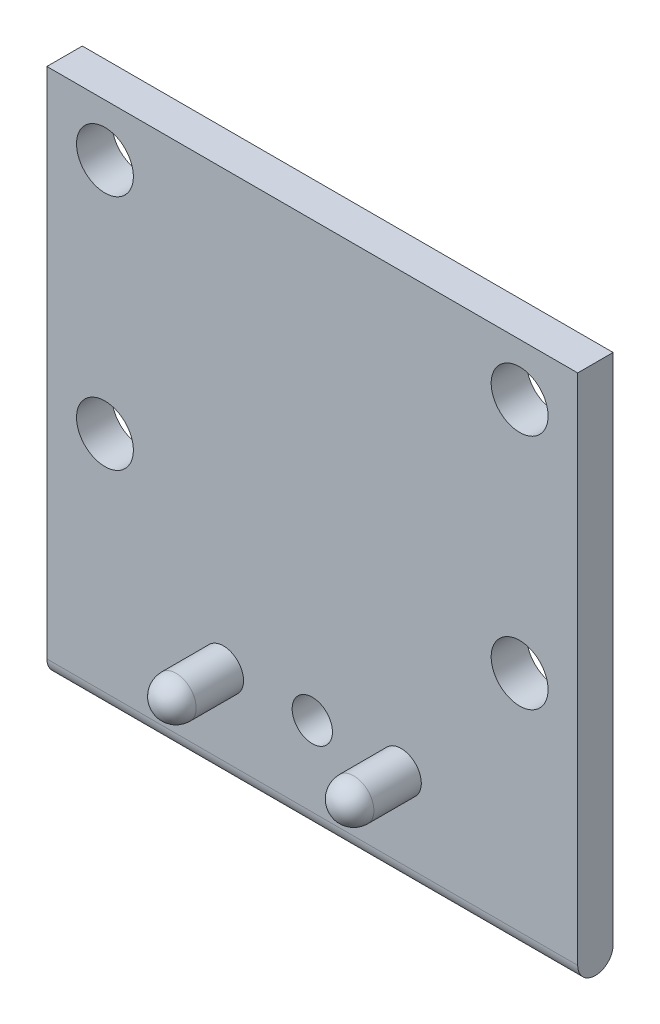
from build123d import *

# Parameters (mm, degrees)
SKETCH1_W            = 44.8
SKETCH1_H            = 2.99
BOSS_EXTRUDE1_DEPTH  = 44.8
FILLET1_RADIUS       = 1.495
FILLET1_LENGTH       = 44.8
M4_CLEARANCE_HOLE1_D = 4.8
M3_CLEARANCE_HOLE1_D = 3.4
SKETCH8_R            = 1.7
BOSS_EXTRUDE2_DEPTH  = 4
REVOLVE1_ANGLE       = 180
REVOLVE2_ANGLE       = 180


with BuildPart() as part:
    # Sketch1 → Boss-Extrude1 (new body)
    with BuildSketch(Plane(origin=(0, 0, 0), x_dir=(1, 0, 0), z_dir=(0, 1, 0))):
        Rectangle(SKETCH1_W, SKETCH1_H)
    extrude(amount=BOSS_EXTRUDE1_DEPTH)

    # Fillet1: full round fillet: the end face becomes a half cylinder, R = half its width
    fillet1_face = Plane((0, 0, 0), x_dir=(-1, 0, 0), z_dir=(0, -1, 0))  # on the end face: x along it, z out of the body
    fillet1_slab = fillet1_face.offset(-FILLET1_RADIUS / 2) * Box(FILLET1_LENGTH, 2 * FILLET1_RADIUS, FILLET1_RADIUS, mode=Mode.PRIVATE)  # the body's end, R deep
    fillet1_round = Plane((0, 1.495, 0), x_dir=(0, -1, 0), z_dir=(-1, 0, 0)) * Cylinder(FILLET1_RADIUS, FILLET1_LENGTH, mode=Mode.PRIVATE)  # its axis R under the face
    add(fillet1_slab - fillet1_round, mode=Mode.SUBTRACT)

    # M4 Clearance Hole1 (through all)
    with Locations(Plane.XY.offset(1.495)):
        with Locations((-17.5, 40.4), (-17.5, 20.4), (17.5, 20.4), (17.5, 40.4)):
            Hole(M4_CLEARANCE_HOLE1_D / 2)

    # M3 Clearance Hole1 (through all)
    with Locations(Plane.XY.offset(1.495)):
        with Locations((0, 8.2)):
            Hole(M3_CLEARANCE_HOLE1_D / 2)

    # Sketch8 → Boss-Extrude2 (add)
    with BuildSketch(Plane.XY.offset(1.495)):
        with Locations(Location((-7.5, 8.2, 0), (0, 0, 180))):
            Circle(SKETCH8_R)
        with Locations(Location((7.5, 8.2, 0), (0, 0, 180))):
            Circle(SKETCH8_R)
    extrude(amount=BOSS_EXTRUDE2_DEPTH)

    # Sketch9 → Revolve1 (revolve)
    with BuildSketch(Plane.XY.offset(5.495)):
        with BuildLine():
            Line((-7.5, 9.9), (-7.5, 6.5))
            ThreePointArc((-7.5, 6.5), (-5.8, 8.2), (-7.5, 9.9))
        make_face()
    revolve(axis=Axis((-7.5, 9.9, 5.495), (0, -1, 0)), revolution_arc=REVOLVE1_ANGLE)

    # Sketch10 → Revolve2 (revolve)
    with BuildSketch(Plane.XY.offset(5.495)):
        with BuildLine():
            Line((7.5, 9.9), (7.5, 6.5))
            ThreePointArc((7.5, 6.5), (9.2, 8.2), (7.5, 9.9))
        make_face()
    revolve(axis=Axis((7.5, 9.9, 5.495), (0, -1, 0)), revolution_arc=REVOLVE2_ANGLE)


solid = part.part
